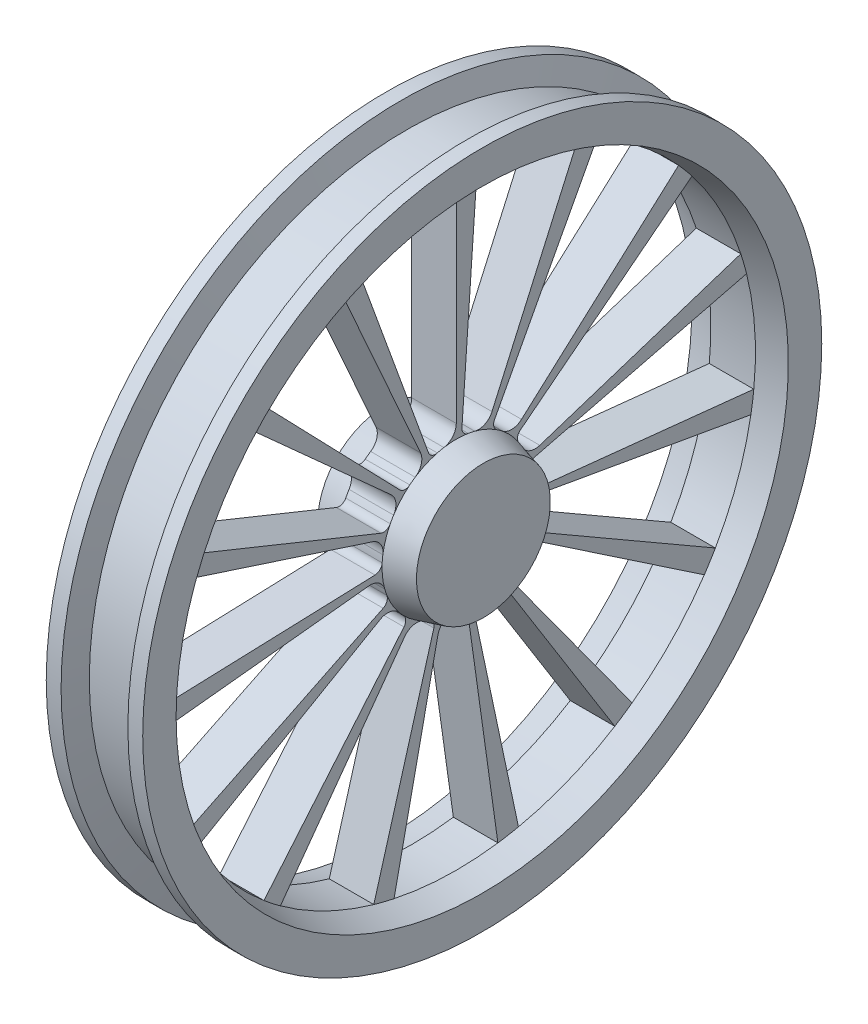
from build123d import *

# Parameters (mm, degrees)
CUT_EXTRUDE1_DEPTH      = 16616.730063788
CUT_EXTRUDE1_DEPTH_BACK = 16616.730063788


with BuildPart() as part:
    # Sketch1 → Revolve1 (revolve)
    with BuildSketch(Plane.XY, mode=Mode.PRIVATE) as revolve1_sk:
        Polygon((-1689.620903129, 0), (1689.620903129, 0), (1689.620903129, 2291.444728124), (762, 2540), (762, 10239.293167929), (1651, 10477.5), (1651, 11620.5), (1143, 11620.5), (938.822715367, 10858.5), (0, 10858.5), (-938.822715367, 10858.5), (-1143, 11620.5), (-1651, 11620.5), (-1651, 10477.5), (-762, 10239.293167929), (-762, 2540), (-1689.620903129, 2291.444728124), align=None)
    revolve(revolve1_sk.sketch.rotate(Axis((-3022.321274336, 0, 0), (1, 0, 0)), 90), axis=Axis((-3022.321274336, 0, 0), (1, 0, 0)))

    # Sketch2 → Cut-Extrude1 (cut, two sides: drawn at the far end of the back side and taken through both)
    with BuildSketch(Plane.ZY.offset(762).offset(-CUT_EXTRUDE1_DEPTH_BACK)):
        with BuildLine():
            ThreePointArc((-1425.03418182, -10139.645070684), (357.34617815, -10233.055667187), (2128.868755323, -10015.54004542))
            Line((2128.868755323, -10015.54004542), (624.851252564, -2939.694016759))
            ThreePointArc((624.851252564, -2939.694016759), (439.28827603, -2643.898292722), (106.626892826, -2537.760963079))
            ThreePointArc((106.626892826, -2537.760963079), (-8.382151286, -2539.986169163), (-123.374003865, -2537.001942287))
            ThreePointArc((-123.374003865, -2537.001942287), (-297.644266258, -2595.014251856), (-387.239493712, -2755.352168872))
            Line((-387.239493712, -2755.352168872), (-1425.03418182, -10139.645070684))
        make_face()
        with BuildLine():
            Line((-1474.46357216, -2359.63496634), (-5425.998701817, -8683.413077049))
            ThreePointArc((-5425.998701817, -8683.413077049), (-3835.706732625, -9493.70730748), (-2128.868755323, -10015.54004542))
            Line((-2128.868755323, -10015.54004542), (-624.851252564, -2939.694016759))
            ThreePointArc((-624.851252564, -2939.694016759), (-674.060507052, -2593.99591452), (-934.791861448, -2361.729064853))
            ThreePointArc((-934.791861448, -2361.729064853), (-1040.762924137, -2316.983499238), (-1144.599414305, -2267.485872232))
            ThreePointArc((-1144.599414305, -2267.485872232), (-1327.398952967, -2249.600652613), (-1474.46357216, -2359.63496634))
        make_face()
        with BuildLine():
            ThreePointArc((2822.331694243, -9842.640315813), (4488.610688334, -9203.015737646), (6018.505518008, -8283.762183242))
            Line((6018.505518008, -8283.762183242), (1766.511299529, -2431.39421498))
            ThreePointArc((1766.511299529, -2431.39421498), (1476.680125379, -2236.64663705), (1129.608888655, -2274.990935954))
            ThreePointArc((1129.608888655, -2274.990935954), (1025.447971672, -2323.80215539), (919.18389266, -2367.847328582))
            ThreePointArc((919.18389266, -2367.847328582), (783.575818101, -2491.726311989), (766.941811158, -2674.643949818))
            Line((766.941811158, -2674.643949818), (2822.331694243, -9842.640315813))
        make_face()
        with BuildLine():
            ThreePointArc((6581.690780293, -7843.753632758), (7843.753632758, -6581.690780293), (8867.488000223, -5119.646583964))
            Line((8867.488000223, -5119.646583964), (2602.725494554, -1502.684264907))
            ThreePointArc((2602.725494554, -1502.684264907), (2258.740565831, -1442.658458535), (1957.271245461, -1618.854308358))
            ThreePointArc((1957.271245461, -1618.854308358), (1881.968824425, -1705.81163787), (1802.806543622, -1789.270400547))
            ThreePointArc((1802.806543622, -1789.270400547), (1729.308524947, -1957.596256157), (1788.511909432, -2131.465493463))
            Line((1788.511909432, -2131.465493463), (6581.690780293, -7843.753632758))
        make_face()
        with BuildLine():
            ThreePointArc((9203.015737646, -4488.610688335), (9842.640315813, -2822.331694243), (10183.2012486, -1070.297579791))
            Line((10183.2012486, -1070.297579791), (2988.904806551, -314.146553974))
            ThreePointArc((2988.904806551, -314.146553974), (2650.244242438, -399.221526399), (2446.503622676, -682.803064018))
            ThreePointArc((2446.503622676, -682.803064018), (2413.080170285, -792.87079135), (2374.707565207, -901.312365247))
            ThreePointArc((2374.707565207, -901.312365247), (2376.028077555, -1084.980023431), (2500.832050444, -1219.737289531))
            Line((2500.832050444, -1219.737289531), (9203.015737646, -4488.610688335))
        make_face()
        with BuildLine():
            ThreePointArc((10239.293167929, 0), (10113.230477899, 1601.778349115), (9738.146489615, 3164.115599277))
            Line((9738.146489615, 3164.115599277), (2858.275324149, 928.709950072))
            ThreePointArc((2858.275324149, 928.709950072), (2583.496612813, 713.244434465), (2512.713297743, 371.311033162))
            ThreePointArc((2512.713297743, 371.311033162), (2526.948032558, 257.164618), (2536.000075228, 142.490766171))
            ThreePointArc((2536.000075228, 142.490766171), (2611.910790016, -24.76088792), (2780.735610588, -97.105427275))
            Line((2780.735610588, -97.105427275), (10233.055667187, -357.34617815))
            ThreePointArc((10233.055667187, -357.34617815), (10237.733673984, -178.700305997), (10239.293167929, 0))
        make_face()
        with BuildLine():
            ThreePointArc((9493.70730748, 3835.706732625), (8683.413077049, 5425.998701817), (7609.277734292, 6851.424446142))
            Line((7609.277734292, 6851.424446142), (2233.424071584, 2010.984066687))
            ThreePointArc((2233.424071584, 2010.984066687), (2070.038948504, 1702.383952988), (2144.452016346, 1361.222079453))
            ThreePointArc((2144.452016346, 1361.222079453), (2203.883623399, 1262.73392863), (2258.795133404, 1161.65594963))
            ThreePointArc((2258.795133404, 1161.65594963), (2396.170398419, 1039.739630058), (2579.824721472, 1042.316845533))
            Line((2579.824721472, 1042.316845533), (9493.70730748, 3835.706732625))
        make_face()
        with BuildLine():
            ThreePointArc((7112.810706685, 7365.531103027), (5725.740076062, 8488.758752619), (4164.695730592, 9354.059763032))
            Line((4164.695730592, 9354.059763032), (1222.393507022, 2745.540768954))
            ThreePointArc((1222.393507022, 2745.540768954), (1198.652744285, 2397.165820366), (1405.395499587, 2115.765461893))
            ThreePointArc((1405.395499587, 2115.765461893), (1499.747714101, 2049.965071422), (1591.023992505, 1979.960266084))
            ThreePointArc((1591.023992505, 1979.960266084), (1766.110376411, 1924.459720261), (1932.838701042, 2001.513066596))
            Line((1932.838701042, 2001.513066596), (7112.810706685, 7365.531103027))
        make_face()
        with BuildLine():
            Line((0, 10239.293167929), (0, 3005.368529815))
            ThreePointArc((0, 3005.368529815), (120.00859116, 2677.455939836), (423.333333333, 2504.473774846))
            ThreePointArc((423.333333333, 2504.473774846), (536.291800254, 2482.738630017), (648.150349303, 2455.911465159))
            ThreePointArc((648.150349303, 2455.911465159), (830.673825712, 2476.423241663), (951.647309913, 2614.62949527))
            Line((951.647309913, 2614.62949527), (3502.044516849, 9621.788231966))
            ThreePointArc((3502.044516849, 9621.788231966), (1778.034599208, 10083.735297141), (0, 10239.293167929))
        make_face()
        with BuildLine():
            Line((-194.092546544, 2775.652731048), (-714.256985027, 10214.350764397))
            ThreePointArc((-714.256985027, 10214.350764397), (-2477.109212786, 9935.142400928), (-4164.695730592, 9354.059763032))
            Line((-4164.695730592, 9354.059763032), (-1222.393507022, 2745.540768954))
            ThreePointArc((-1222.393507022, 2745.540768954), (-979.386137619, 2494.789603384), (-631.927012117, 2460.135819697))
            ThreePointArc((-631.927012117, 2460.135819697), (-519.893837915, 2486.22412451), (-406.794377555, 2507.213260652))
            ThreePointArc((-406.794377555, 2507.213260652), (-248.393775888, 2600.190686983), (-194.092546544, 2775.652731048))
        make_face()
        with BuildLine():
            Line((-1306.272038429, 2456.740393615), (-4807.05696537, 9040.7592552))
            ThreePointArc((-4807.05696537, 9040.7592552), (-6303.938338059, 8068.67312566), (-7609.277734292, 6851.424446142))
            Line((-7609.277734292, 6851.424446142), (-2233.424071584, 2010.984066687))
            ThreePointArc((-2233.424071584, 2010.984066687), (-1909.436105761, 1880.751480055), (-1577.921436295, 1990.418031691))
            ThreePointArc((-1577.921436295, 1990.418031691), (-1486.185108421, 2059.818881239), (-1391.400660923, 2124.995106061))
            ThreePointArc((-1391.400660923, 2124.995106061), (-1284.511837049, 2274.361540533), (-1306.272038429, 2456.740393615))
        make_face()
        with BuildLine():
            Line((-2192.58522776, 1713.03532334), (-8068.67312566, 6303.938338059))
            ThreePointArc((-8068.67312566, 6303.938338059), (-9040.759255199, 4807.05696537), (-9738.146489615, 3164.115599277))
            Line((-9738.146489615, 3164.115599277), (-2858.275324149, 928.709950072))
            ThreePointArc((-2858.275324149, 928.709950072), (-2509.327224534, 941.514339734), (-2251.078909172, 1176.538883625))
            ThreePointArc((-2251.078909172, 1176.538883625), (-2195.501472113, 1277.252240534), (-2135.421129539, 1375.345992658))
            ThreePointArc((-2135.421129539, 1375.345992658), (-2098.526132161, 1555.274621798), (-2192.58522776, 1713.03532334))
        make_face()
        with BuildLine():
            Line((-2699.7805122, 673.130883222), (-9935.142400928, 2477.109212786))
            ThreePointArc((-9935.142400928, 2477.109212786), (-10214.350764397, 714.256985027), (-10183.2012486, -1070.29757979))
            Line((-10183.2012486, -1070.29757979), (-2988.904806551, -314.146553974))
            ThreePointArc((-2988.904806551, -314.146553974), (-2675.332869663, -160.519183317), (-2535.004388243, 159.225474061))
            ThreePointArc((-2535.004388243, 159.225474061), (-2525.195685772, 273.837083968), (-2510.207885165, 387.887062498))
            ThreePointArc((-2510.207885165, 387.887062498), (-2549.686194511, 567.266591728), (-2699.7805122, 673.130883222))
        make_face()
        with BuildLine():
            Line((-2740.159219344, -483.164001807), (-10083.735297141, -1778.034599208))
            ThreePointArc((-10083.735297141, -1778.034599208), (-9621.788231966, -3502.044516848), (-8867.488000223, -5119.646583964))
            Line((-8867.488000223, -5119.646583964), (-2602.725494554, -1502.684264907))
            ThreePointArc((-2602.725494554, -1502.684264907), (-2378.749156991, -1234.797481301), (-2380.604578795, -885.619466487))
            ThreePointArc((-2380.604578795, -885.619466487), (-2418.260624679, -776.926992148), (-2450.956892924, -666.641064611))
            ThreePointArc((-2450.956892924, -666.641064611), (-2559.982350659, -518.826985507), (-2740.159219344, -483.164001807))
        make_face()
        with BuildLine():
            Line((-2306.739503899, -1555.915441517), (-8488.758752619, -5725.740076062))
            ThreePointArc((-8488.758752619, -5725.740076062), (-7365.531103027, -7112.810706685), (-6018.505518008, -8283.762183242))
            Line((-6018.505518008, -8283.762183242), (-1766.511299529, -2431.39421498))
            ThreePointArc((-1766.511299529, -2431.39421498), (-1670.858104818, -2095.568076985), (-1814.57661056, -1777.332755679))
            ThreePointArc((-1814.57661056, -1777.332755679), (-1893.18633237, -1693.353333161), (-1967.913187652, -1605.900895405))
            ThreePointArc((-1967.913187652, -1605.900895405), (-2127.634301667, -1515.210663552), (-2306.739503899, -1555.915441517))
        make_face()
    extrude(amount=CUT_EXTRUDE1_DEPTH + CUT_EXTRUDE1_DEPTH_BACK, mode=Mode.SUBTRACT)


solid = part.part
